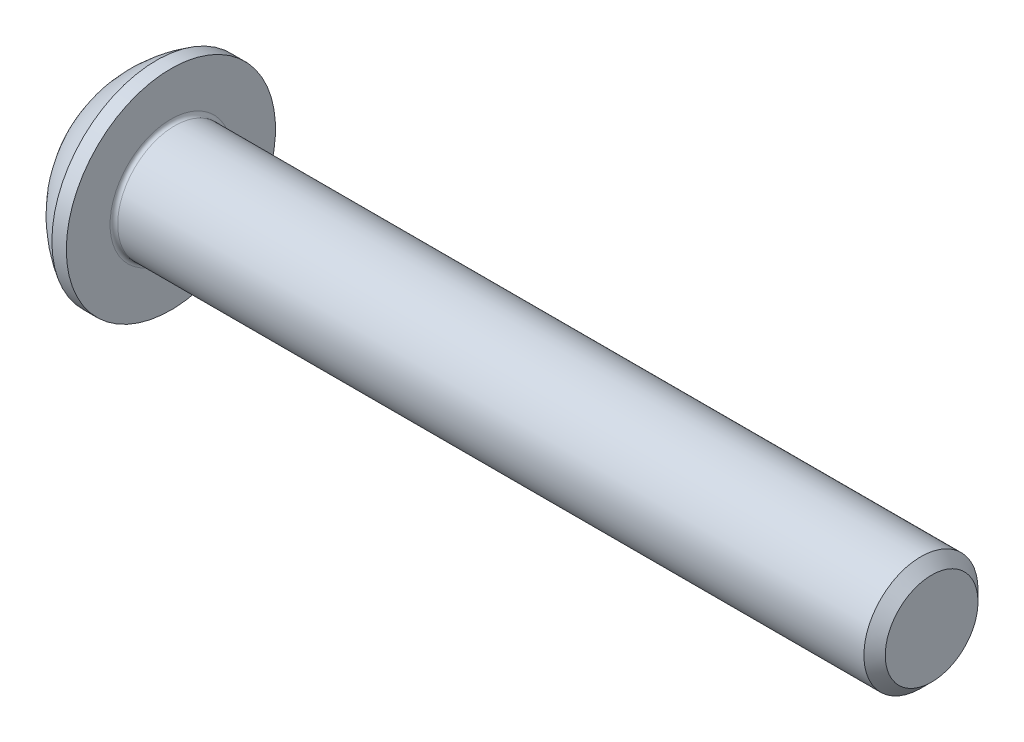
from build123d import *

# Parameters (mm, degrees)
CUT_EXTRUDE1_DEPTH        = 1.04
SKETCH4_R                 = 1.5
LARGO_Y_ANCHO_ROSCA_DEPTH = 20
FILLET1_R                 = 0.1
CHAMFER1_SIZE             = 0.2805


with BuildPart() as part:
    # Sketch1 → Revolve1 (revolve)
    with BuildSketch(Plane(origin=(0, 0, 0), x_dir=(-1, 0, 0), z_dir=(0, 0, -1)), mode=Mode.PRIVATE) as revolve1_sk:
        with BuildLine():
            Line((-1.65, 2.75), (-1.65, 0))
            Line((-1.65, 0), (0, 0))
            Line((0, 0), (0, 1.425))
            ThreePointArc((0, 1.425), (-0.542530893, 2.176130767), (-1.27, 2.75))
            Line((-1.27, 2.75), (-1.65, 2.75))
        make_face()
    revolve(revolve1_sk.sketch.rotate(Axis((1.65, 0, 0), (-1, 0, 0)), 270), axis=Axis((1.65, 0, 0), (-1, 0, 0)))

    # Sketch2 → Cut-Extrude1 (cut)
    with BuildSketch(Plane.ZY):
        Polygon((-1, 0.577350269), (-1, -0.577350269), (0, -1.154700538), (1, -0.577350269), (1, 0.577350269), (0, 1.154700538), align=None)
    extrude(amount=-CUT_EXTRUDE1_DEPTH, mode=Mode.SUBTRACT)

    # Sketch3 → Cut-Revolve1 (revolve, cut)
    with BuildSketch(Plane.XY, mode=Mode.PRIVATE) as cut_revolve1_sk:
        Polygon((1.04, 1), (1.04, 0), (1.617350269, 0), align=None)
    revolve(cut_revolve1_sk.sketch.rotate(Axis((1.04, 0, 0), (1, 0, 0)), 90), axis=Axis((1.04, 0, 0), (1, 0, 0)), mode=Mode.SUBTRACT)

    # Sketch4 → Largo y Ancho rosca (add)
    with BuildSketch(Plane(origin=(1.65, 0, 0), x_dir=(0, 0, -1), z_dir=(1, 0, 0))):
        Circle(SKETCH4_R)
    extrude(amount=LARGO_Y_ANCHO_ROSCA_DEPTH)

    # Fillet1
    fillet1_edges = [part.edges().sort_by_distance(p)[0] for p in [
        (1.65, 0, 1.5),
    ]]
    fillet(fillet1_edges, radius=FILLET1_R)

    # Chamfer1
    chamfer1_edges = [part.edges().sort_by_distance(p)[0] for p in [
        (21.65, 0, 1.5),
    ]]
    chamfer(chamfer1_edges, length=CHAMFER1_SIZE)


solid = part.part
